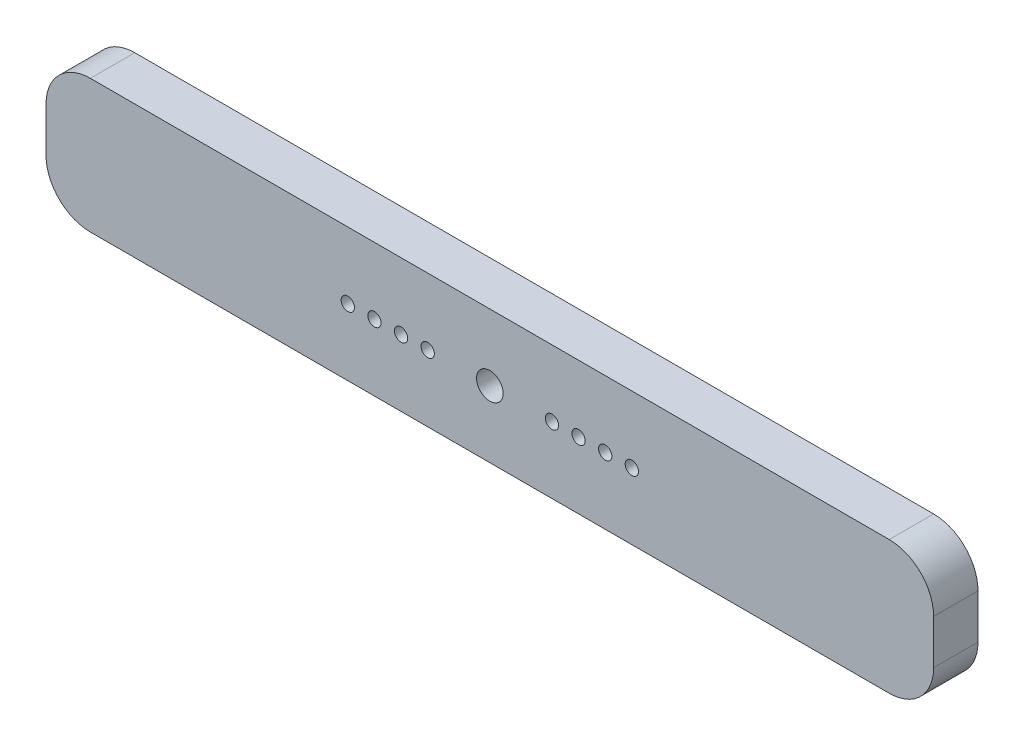
from build123d import *

# Parameters (mm, degrees)
SKETCH2_W           = 150
SKETCH2_H           = 15
BOSS_EXTRUDE1_DEPTH = 5
FILLET2_R           = 5
SKETCH6_R           = 1.5
SKETCH6_R_2         = 0.75
CUT_EXTRUDE4_DEPTH  = 134.599949611
SKETCH7_W           = 25
SKETCH7_H           = 15
SKETCH7_W_2         = 30.364729536
CUT_EXTRUDE6_DEPTH  = 45
FILLET3_R           = 5


with BuildPart() as part:
    # Sketch2 → Boss-Extrude1 (new body)
    with BuildSketch(Plane.XY):
        with Locations((-58.131313131, 2.5)):
            Rectangle(SKETCH2_W, SKETCH2_H)
    extrude(amount=BOSS_EXTRUDE1_DEPTH)

    # Fillet2
    fillet2_edges = [part.edges().sort_by_distance(p)[0] for p in [
        (-133.131313131, 10, 2.5),
        (16.868686869, 10, 2.5),
        (16.868686869, -5, 2.5),
        (-133.131313131, -5, 2.5),
    ]]
    fillet(fillet2_edges, radius=FILLET2_R)

    # Sketch6 → Cut-Extrude4 (cut, through all)
    with BuildSketch(Plane.XY):
        with Locations((-58.131313131, 2.5)):
            Circle(SKETCH6_R)
        with Locations((-51.131313131, 2.5)):
            Circle(SKETCH6_R_2)
        with Locations((-48.131313131, 2.5)):
            Circle(SKETCH6_R_2)
        with Locations((-45.131313131, 2.5)):
            Circle(SKETCH6_R_2)
        with Locations(Location((-65.131313131, 2.5, 0), (0, 0, 180))):
            Circle(SKETCH6_R_2)
        with Locations(Location((-68.131313131, 2.5, 0), (0, 0, 180))):
            Circle(SKETCH6_R_2)
        with Locations(Location((-71.131313131, 2.5, 0), (0, 0, 180))):
            Circle(SKETCH6_R_2)
        with Locations((-74.131313131, 2.5)):
            Circle(SKETCH6_R_2)
        with Locations(Location((-42.131313131, 2.5, 0), (0, 0, 180))):
            Circle(SKETCH6_R_2)
    extrude(amount=CUT_EXTRUDE4_DEPTH, mode=Mode.SUBTRACT)

    # Sketch7 → Cut-Extrude6 (cut)
    with BuildSketch(Plane.XY):
        with Locations((-120.631313131, 2.5)):
            Rectangle(SKETCH7_W, SKETCH7_H)
        with Locations((7.051051637, 2.5)):
            Rectangle(SKETCH7_W_2, SKETCH7_H)
    extrude(amount=CUT_EXTRUDE6_DEPTH, mode=Mode.SUBTRACT)

    # Fillet3
    fillet3_edges = [part.edges().sort_by_distance(p)[0] for p in [
        (-8.131313131, 10, 2.5),
        (-8.131313131, -5, 2.5),
        (-108.131313131, -5, 2.5),
        (-108.131313131, 10, 2.5),
    ]]
    fillet(fillet3_edges, radius=FILLET3_R)


solid = part.part
